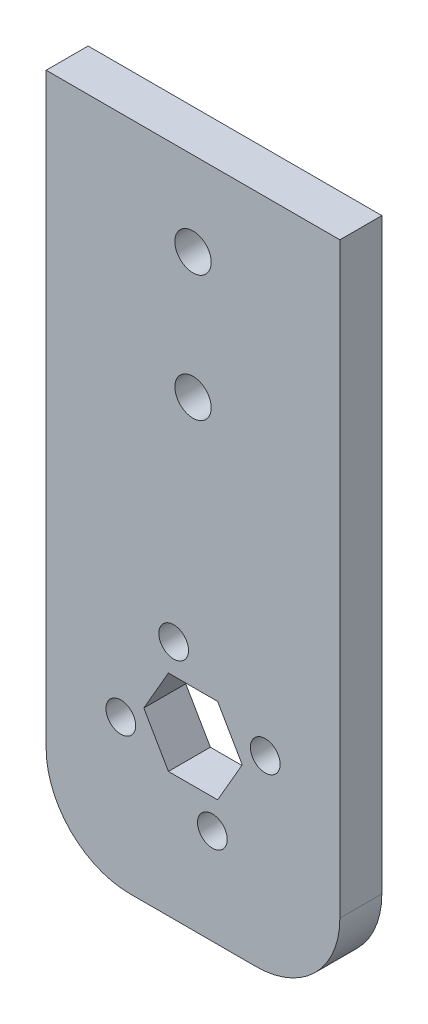
from build123d import *

# Parameters (mm, degrees)
SKETCH1_W            = 44.45
SKETCH1_H            = 101.6
BOSS_EXTRUDE2_DEPTH  = 6.35
FILLET1_R            = 12.7
M5_CLEARANCE_HOLE1_D = 5.5
CUT_EXTRUDE1_DEPTH   = 112.079633597
M4_CLEARANCE_HOLE1_D = 4.5


with BuildPart() as part:
    # Sketch1 → Boss-Extrude2 (new body)
    with BuildSketch(Plane.XY):
        with Locations((-22.225, 50.8)):
            Rectangle(SKETCH1_W, SKETCH1_H)
    extrude(amount=BOSS_EXTRUDE2_DEPTH)

    # Fillet1
    fillet1_edges = [part.edges().sort_by_distance(p)[0] for p in [
        (0, 0, 3.175),
        (-44.45, 0, 3.175),
    ]]
    fillet(fillet1_edges, radius=FILLET1_R)

    # M5 Clearance Hole1 (through all)
    with Locations(Plane(origin=(0, 0, 0), x_dir=(-1, 0, 0), z_dir=(0, 0, -1))):
        with Locations((22.225, 88.9), (22.225, 69.85)):
            Hole(M5_CLEARANCE_HOLE1_D / 2)

    # Sketch14 → Cut-Extrude1 (cut, through all)
    with BuildSketch(Plane.XY.offset(6.35)):
        Polygon((-14.777181527, 25.4), (-18.501090764, 31.85), (-25.948909236, 31.85), (-29.672818473, 25.4), (-25.948909236, 18.95), (-18.501090764, 18.95), align=None)
    extrude(amount=-CUT_EXTRUDE1_DEPTH, mode=Mode.SUBTRACT)

    # M4 Clearance Hole1 (through all)
    with Locations(Plane(origin=(0, 0, 0), x_dir=(-1, 0, 0), z_dir=(0, 0, -1))):
        with Locations((11.29679677, 28.32820323), (25.15320323, 36.32820323), (33.15320323, 22.47179677), (19.29679677, 14.47179677)):
            Hole(M4_CLEARANCE_HOLE1_D / 2)


solid = part.part
